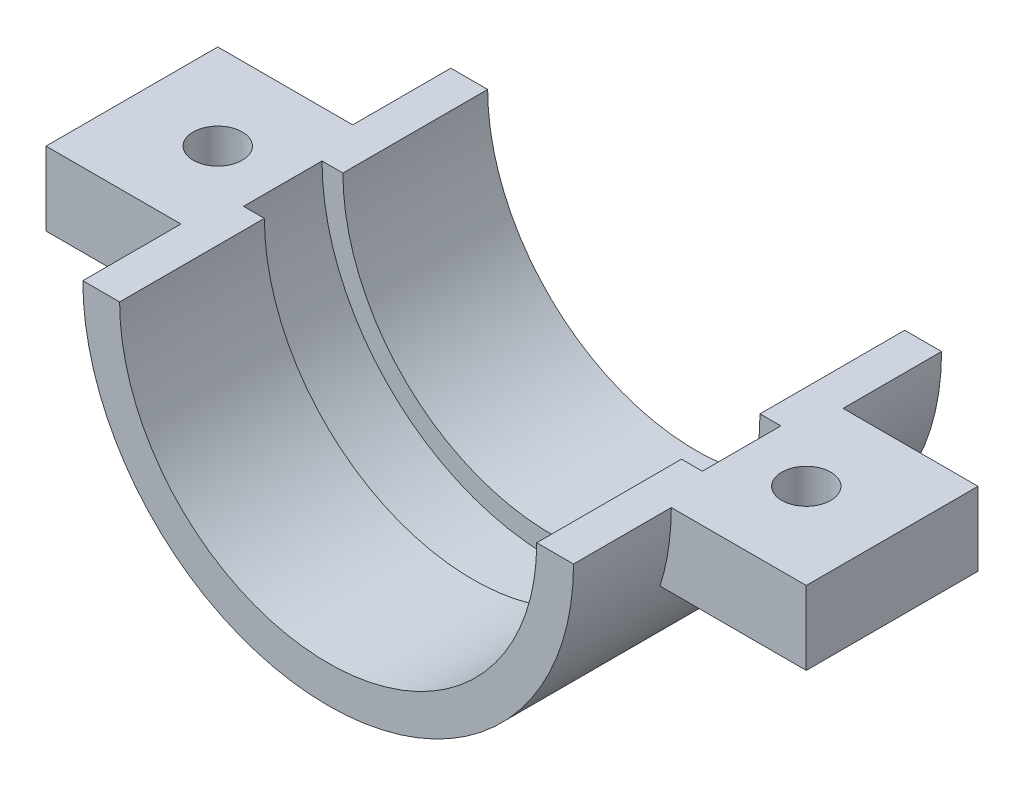
from build123d import *

# Parameters (mm, degrees)
BOSS_EXTRUDE1_DEPTH = 15
SKETCH2_W           = 7
SKETCH2_H           = 7
SKETCH2_R           = 1
BOSS_EXTRUDE2_DEPTH = 3
CUT_EXTRUDE1_DEPTH  = 1.6


with BuildPart() as part:
    # Sketch1 → Boss-Extrude1 (new body)
    with BuildSketch(Plane.XY):
        with BuildLine():
            Line((-10, 0), (-8.5, 0))
            ThreePointArc((-8.5, 0), (0, -8.5), (8.5, 0))
            Line((8.5, 0), (10, 0))
            ThreePointArc((10, 0), (0, -10), (-10, 0))
        make_face()
    extrude(amount=BOSS_EXTRUDE1_DEPTH)

    # Sketch2 → Boss-Extrude2 (add)
    # profile 1 of 2: a face of its own
    with BuildSketch(Plane(origin=(0, 0, 0), x_dir=(1, 0, 0), z_dir=(0, 1, 0))):
        with Locations((-12, -7.5)):
            Rectangle(SKETCH2_W, SKETCH2_H)
        with Locations(Location((-12, -7.5, 0), (0, 0, 270))):
            Circle(SKETCH2_R, mode=Mode.SUBTRACT)
    # profile 2 of 2: a face of its own
    with BuildSketch(Plane(origin=(0, 0, 0), x_dir=(1, 0, 0), z_dir=(0, 1, 0))):
        with Locations((12, -7.514851196)):
            Rectangle(SKETCH2_W, SKETCH2_H)
        with Locations(Location((12, -7.514851196, 0), (0, 0, 270))):
            Circle(SKETCH2_R, mode=Mode.SUBTRACT)
    extrude(amount=-BOSS_EXTRUDE2_DEPTH)

    # Sketch3 → Cut-Extrude1 (cut, symmetric)
    with BuildSketch(Plane(origin=(0, 0, 7.5), x_dir=(-1, 0, 0), z_dir=(0, 0, -1))):
        with BuildLine():
            Line((-9.35, 0), (-8.5, 0))
            ThreePointArc((-8.5, 0), (0, -8.5), (8.5, 0))
            Line((8.5, 0), (9.35, 0))
            ThreePointArc((9.35, 0), (0, -9.35), (-9.35, 0))
        make_face()
    extrude(amount=CUT_EXTRUDE1_DEPTH, both=True, mode=Mode.SUBTRACT)


solid = part.part
